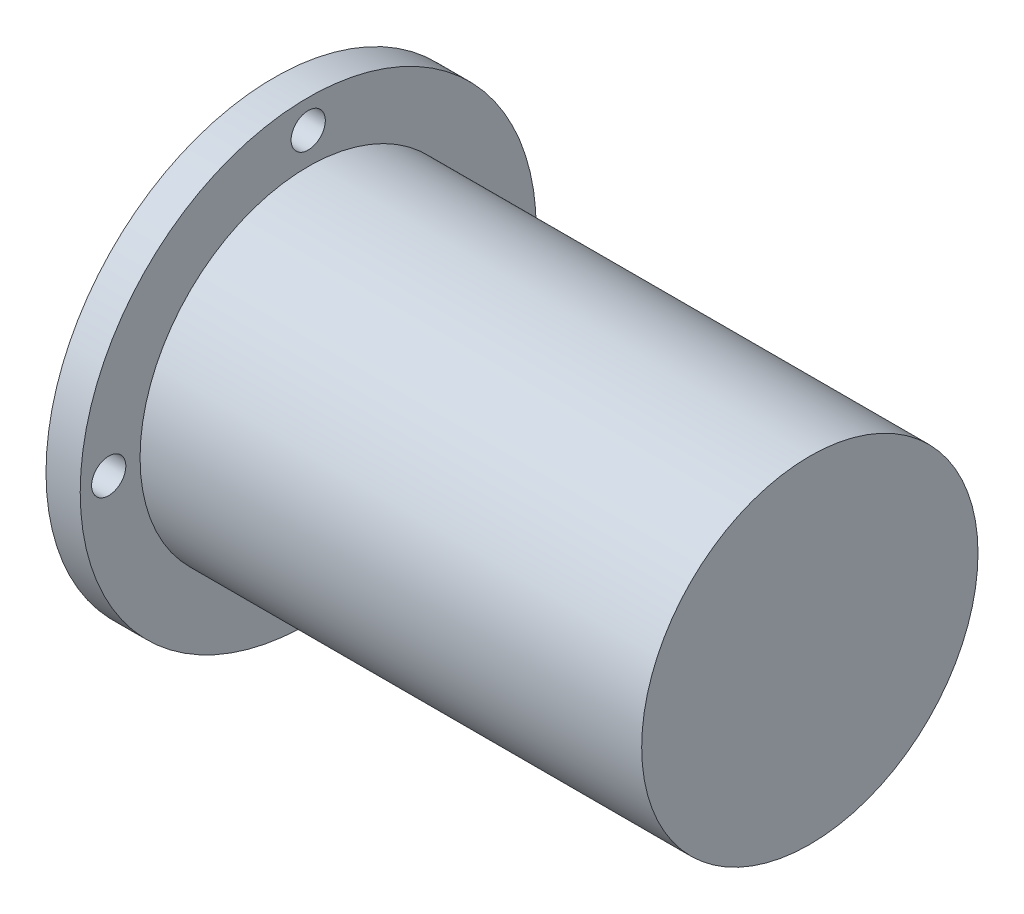
from build123d import *

# Parameters (mm, degrees)
SKETCH1_R           = 14.75
BOSS_EXTRUDE1_DEPTH = 47
SKETCH2_R           = 20
SKETCH2_R_2         = 1.5
BOSS_EXTRUDE2_DEPTH = 3


with BuildPart() as part:
    # Sketch1 → Boss-Extrude1 (new body)
    with BuildSketch(Plane(origin=(0, 0, 0), x_dir=(0, 0, -1), z_dir=(1, 0, 0))):
        Circle(SKETCH1_R)
    extrude(amount=BOSS_EXTRUDE1_DEPTH)

    # Sketch2 → Boss-Extrude2 (add)
    with BuildSketch(Plane.ZY):
        Circle(SKETCH2_R)
        with Locations((0, 17.5)):
            Circle(SKETCH2_R_2, mode=Mode.SUBTRACT)
        with Locations((17.5, 0)):
            Circle(SKETCH2_R_2, mode=Mode.SUBTRACT)
        with Locations((0, -17.5)):
            Circle(SKETCH2_R_2, mode=Mode.SUBTRACT)
        with Locations((-17.5, 0)):
            Circle(SKETCH2_R_2, mode=Mode.SUBTRACT)
    extrude(amount=-BOSS_EXTRUDE2_DEPTH)


solid = part.part
